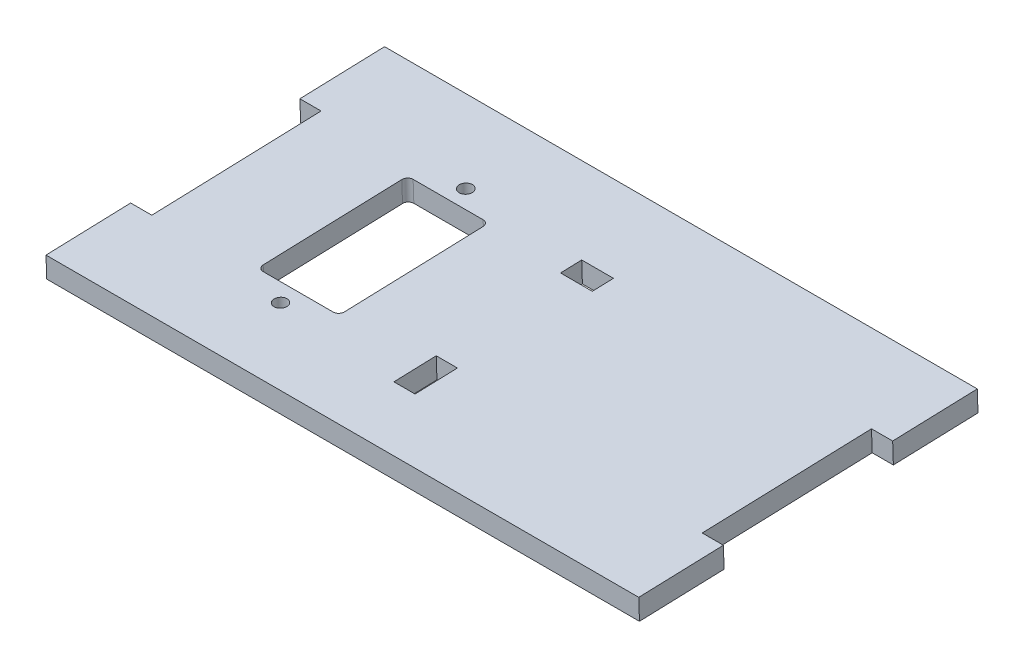
from build123d import *

# Parameters (mm, degrees)
SKETCH3_W           = 4.7625
SKETCH3_H           = 3.175
SKETCH3_W_2         = 3.175
SKETCH3_H_2         = 6.35
BOSS_EXTRUDE2_DEPTH = 3.175


with BuildPart() as part:
    # Sketch3 → Boss-Extrude2 (new body)
    with BuildSketch(Plane(origin=(0, 88.979885655, 2.951534319), x_dir=(1, 0, 0), z_dir=(0, 0.9994503024750413, 0.03315256977292581))):
        Polygon((73.130884883, -481.824366224), (73.130884883, -469.124366224), (-15.769115117, -469.124366224), (-15.769115117, -481.824366224), (-12.594115117, -481.824366224), (-12.594115117, -507.224366224), (-15.769115117, -507.224366224), (-15.769115117, -519.924366224), (73.130884883, -519.924366224), (73.130884883, -507.224366224), (69.955884883, -507.224366224), (69.955884883, -481.824366224), align=None)
        with Locations((28.684303559, -483.221366224)):
            Rectangle(SKETCH3_W, SKETCH3_H, mode=Mode.SUBTRACT)
        with Locations((28.680884883, -507.426337868)):
            Rectangle(SKETCH3_W_2, SKETCH3_H_2, mode=Mode.SUBTRACT)
        with BuildLine():
            Line((13.62075844, -483.734366224), (3.12075844, -483.734366224))
            ThreePointArc((3.12075844, -483.734366224), (2.519717676, -483.98332546), (2.27075844, -484.584366224))
            Line((2.27075844, -484.584366224), (2.27075844, -505.384366224))
            ThreePointArc((2.27075844, -505.384366224), (2.519717676, -505.985406988), (3.12075844, -506.234366224))
            Line((3.12075844, -506.234366224), (13.62075844, -506.234366224))
            ThreePointArc((13.62075844, -506.234366224), (14.221799204, -505.985406988), (14.47075844, -505.384366224))
            Line((14.47075844, -505.384366224), (14.47075844, -484.584366224))
            ThreePointArc((14.47075844, -484.584366224), (14.221799204, -483.98332546), (13.62075844, -483.734366224))
        make_face(mode=Mode.SUBTRACT)
        with BuildLine():
            ThreePointArc((9.350271075, -508.884366224), (9.063378466, -508.191746198), (8.37075844, -507.904853589))
            ThreePointArc((8.37075844, -507.904853589), (7.678138413, -508.191746198), (7.391245805, -508.884366224))
            ThreePointArc((7.391245805, -508.884366224), (7.678138413, -509.576986251), (8.37075844, -509.863878859))
            ThreePointArc((8.37075844, -509.863878859), (9.063378466, -509.576986251), (9.350271075, -508.884366224))
        make_face(mode=Mode.SUBTRACT)
        with BuildLine():
            ThreePointArc((8.37075844, -482.084366224), (9.077865221, -481.791473005), (9.37075844, -481.084366224))
            ThreePointArc((9.37075844, -481.084366224), (9.077865221, -480.377259443), (8.37075844, -480.084366224))
            ThreePointArc((8.37075844, -480.084366224), (7.663651658, -480.377259443), (7.37075844, -481.084366224))
            ThreePointArc((7.37075844, -481.084366224), (7.663651658, -481.791473005), (8.37075844, -482.084366224))
        make_face(mode=Mode.SUBTRACT)
    extrude(amount=BOSS_EXTRUDE2_DEPTH)


solid = part.part
